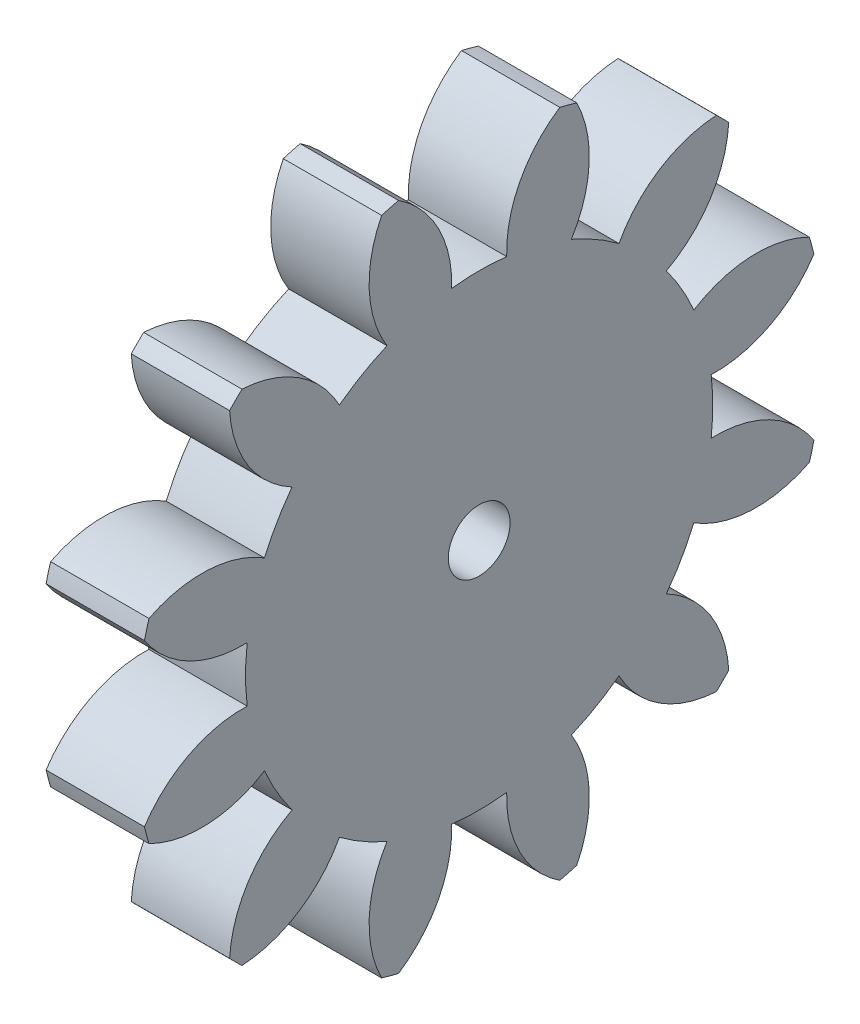
from build123d import *

# Parameters (mm, degrees)
BASPROSKE_W     = 12.7
BASPROSKE_H     = 44.45
TOOTHCUT_DEPTH  = 65.131856359
TEETHCUTS_COUNT = 12
BORSKE_R        = 3.9878
BORE_DEPTH      = 25.4000508


with BuildPart() as part:
    # BasProSke → Base-Revolve (revolve)
    with BuildSketch(Plane(origin=(0, 0, 0), x_dir=(1, 0, 0), z_dir=(0, 1, 0)), mode=Mode.PRIVATE) as base_revolve_sk:
        with Locations((6.35, 22.225)):
            Rectangle(BASPROSKE_W, BASPROSKE_H)
    revolve(base_revolve_sk.sketch.rotate(Axis((-10, 0, 0), (1, 0, 0)), 180), axis=Axis((-10, 0, 0), (1, 0, 0)))

    # TooCutSke → ToothCut (cut, through all)
    with BuildSketch(Plane(origin=(0, 0, 0), x_dir=(0, 0, -1), z_dir=(1, 0, 0))):
        with BuildLine():
            ThreePointArc((3.552242783, 29.951316604), (0, 30.16123), (-3.552242783, 29.951316604))
            ThreePointArc((-3.552242783, 29.951316604), (-5.254049238, 37.49538421), (-10.439744342, 43.232776261))
            ThreePointArc((-10.439744342, 43.232776261), (0, 44.4754), (10.439744342, 43.232776261))
            ThreePointArc((10.439744342, 43.232776261), (5.254049238, 37.49538421), (3.552242783, 29.951316604))
        make_face()
    toothcut = extrude(amount=TOOTHCUT_DEPTH, mode=Mode.SUBTRACT)

    # TeethCuts: ToothCut ×12 about axis
    teethcuts_axis = Axis((0, 0, 0), (1, 0, 0))
    for i in range(1, TEETHCUTS_COUNT):
        add(toothcut.rotate(teethcuts_axis, i * 360 / TEETHCUTS_COUNT), mode=Mode.SUBTRACT)

    # BorSke → Bore (cut, symmetric)
    with BuildSketch(Plane(origin=(0, 0, 0), x_dir=(0, 0, -1), z_dir=(1, 0, 0))):
        with Locations(Location((0, 0, 0), (0, 0, 180))):
            Circle(BORSKE_R)
    extrude(amount=BORE_DEPTH, both=True, mode=Mode.SUBTRACT)


solid = part.part
